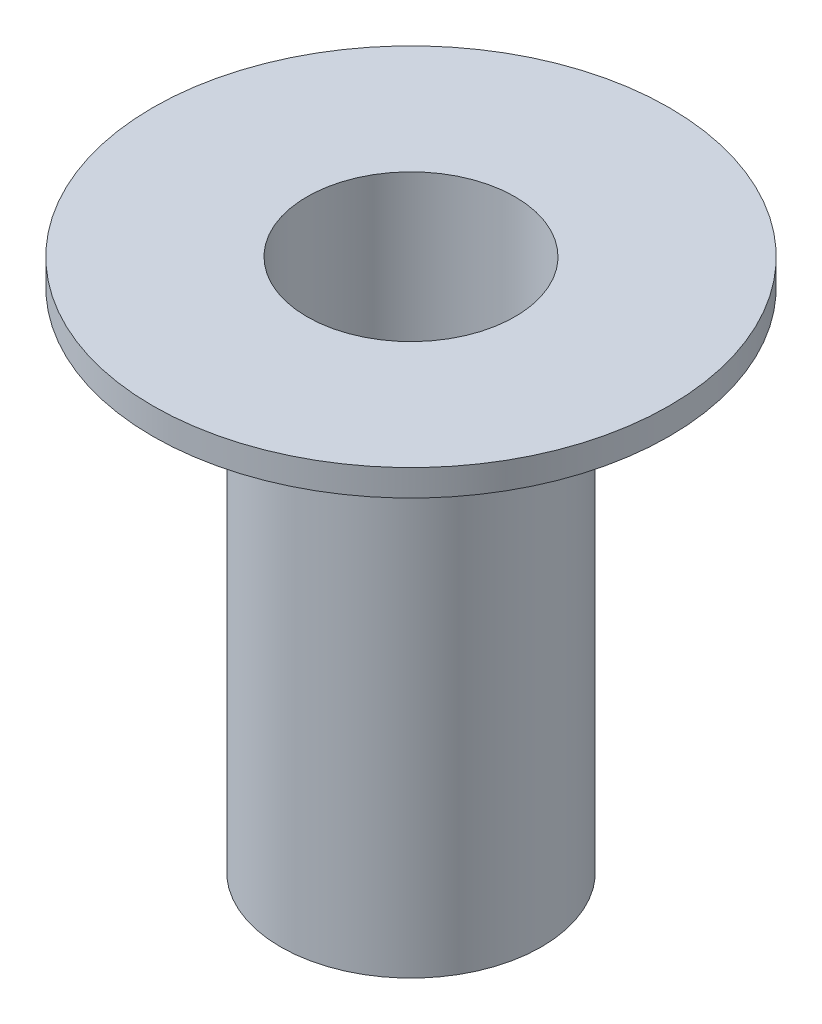
from build123d import *

# Parameters (mm, degrees)
SKETCH1_R           = 1.881
SKETCH1_R_2         = 1.5
BOSS_EXTRUDE1_DEPTH = 7.3
SKETCH2_R           = 3.725
SKETCH2_R_2         = 1.5
BOSS_EXTRUDE2_DEPTH = 0.381


with BuildPart() as part:
    # Sketch1 → Boss-Extrude1 (new body)
    with BuildSketch(Plane(origin=(0, 0, 0), x_dir=(1, 0, 0), z_dir=(0, 1, 0))):
        with Locations(Location((0, 0, 0), (0, 0, 270))):
            Circle(SKETCH1_R)
        with Locations(Location((0, 0, 0), (0, 0, 270))):
            Circle(SKETCH1_R_2, mode=Mode.SUBTRACT)
    extrude(amount=BOSS_EXTRUDE1_DEPTH)

    # Sketch2 → Boss-Extrude2 (add)
    with BuildSketch(Plane(origin=(0, 7.3, 0), x_dir=(-1, 0, 0), z_dir=(0, 1, 0))):
        with Locations(Location((0, 0, 0), (0, 0, 270))):
            Circle(SKETCH2_R)
        with Locations(Location((0, 0, 0), (0, 0, 90))):
            Circle(SKETCH2_R_2, mode=Mode.SUBTRACT)
    extrude(amount=BOSS_EXTRUDE2_DEPTH)


solid = part.part
